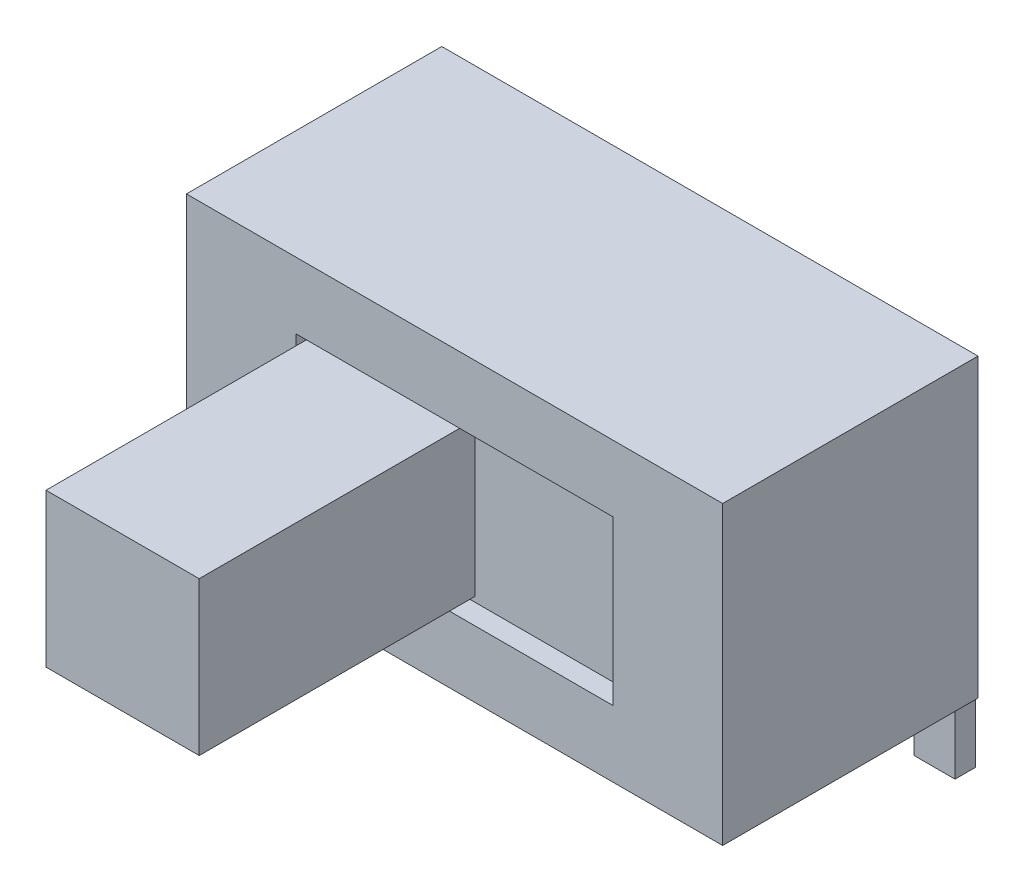
from build123d import *

# Parameters (mm, degrees)
SKETCH1_W            = 10.5
SKETCH1_H            = 5
BOSS_EXTRUDE1_DEPTH  = 5.8
SKETCH2_W            = 6.2
SKETCH2_H            = 3.2
CUT_EXTRUDE1_DEPTH   = 0.4
SKETCH3_W            = 3
SKETCH3_H            = 3
BOSS_EXTRUDE2_DEPTH  = 5.4
BOSS_EXTRUDE3_DEPTH  = 0.4
LPATTERN1_COUNT      = 2
LPATTERN1_PITCH      = 3
LPATTERN1_COUNT_DIR2 = 2
LPATTERN1_PITCH_DIR2 = 3


with BuildPart() as part:
    # Sketch1 → Boss-Extrude1 (new body)
    with BuildSketch(Plane(origin=(0, 0, 0), x_dir=(1, 0, 0), z_dir=(0, 1, 0))):
        Rectangle(SKETCH1_W, SKETCH1_H)
    extrude(amount=BOSS_EXTRUDE1_DEPTH)

    # Sketch2 → Cut-Extrude1 (cut)
    with BuildSketch(Plane.XY.offset(2.5)):
        with Locations((0, 2.9)):
            Rectangle(SKETCH2_W, SKETCH2_H)
    extrude(amount=-CUT_EXTRUDE1_DEPTH, mode=Mode.SUBTRACT)

    # Sketch3 → Boss-Extrude2 (add)
    with BuildSketch(Plane.XY.offset(2.1)):
        with Locations((-1.5, 2.9)):
            Rectangle(SKETCH3_W, SKETCH3_H)
    extrude(amount=BOSS_EXTRUDE2_DEPTH)


with BuildPart() as body_2:
    # Sketch4 → Boss-Extrude3 (new, symmetric)
    with BuildSketch(Plane(origin=(0, 0, 0), x_dir=(0, 0, -1), z_dir=(1, 0, 0))):
        Polygon((2.5, 3.1), (4.3, 3.1), (4.3, -3), (3.9, -3), (3.9, 2.7), (2.5, 2.7), align=None)
    boss_extrude3 = extrude(amount=BOSS_EXTRUDE3_DEPTH, both=True)


with BuildPart() as lpattern1_1:
    # LPattern1: Boss-Extrude3 2 × 2
    with Locations(*[Vector(-1, 0, 0) * (i * LPATTERN1_PITCH) + Vector(1, 0, 0) * (j * LPATTERN1_PITCH_DIR2) for i in range(LPATTERN1_COUNT) for j in range(LPATTERN1_COUNT_DIR2) if (i, j) != (0, 0)]):
        add(boss_extrude3)


solid = Compound([part.part, body_2.part, lpattern1_1.part])
